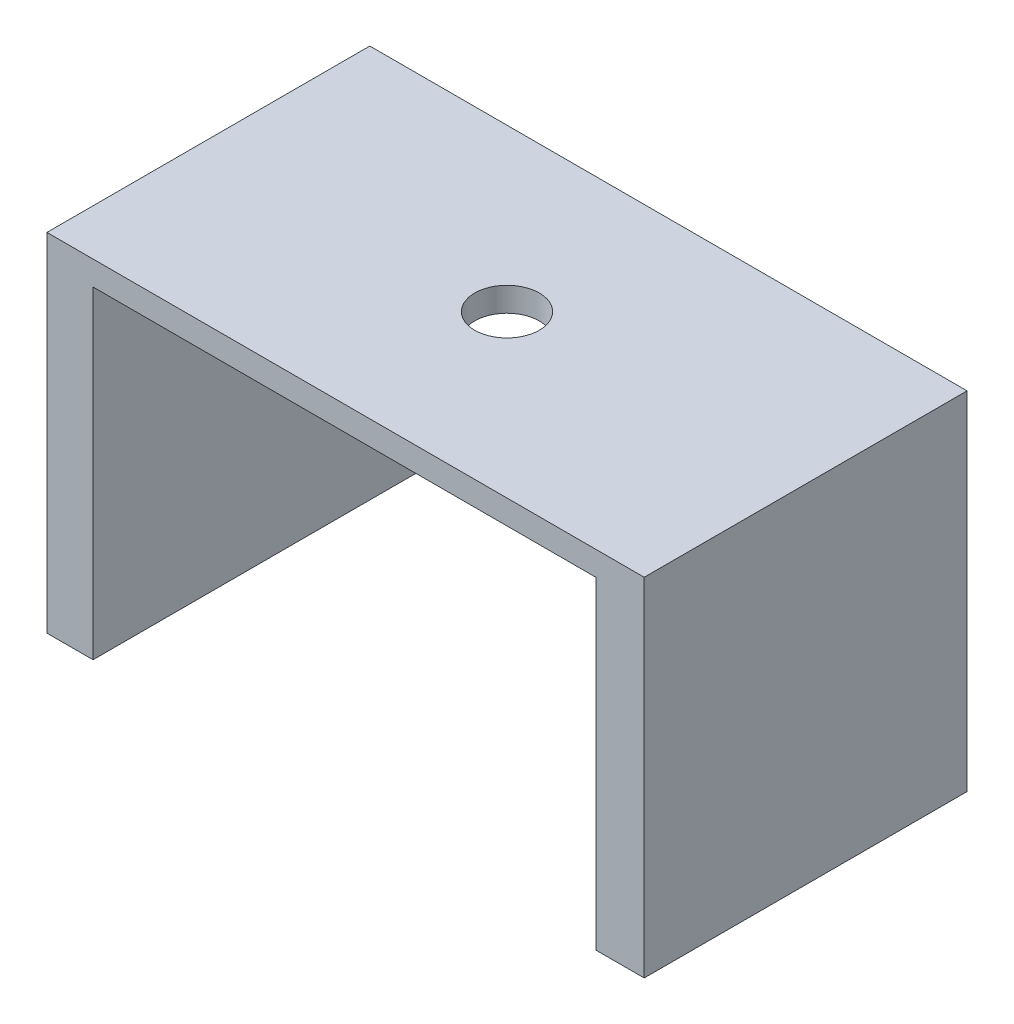
from build123d import *

# Parameters (mm, degrees)
SKETCH1_W           = 370
SKETCH1_H           = 200
BOSS_EXTRUDE1_DEPTH = 15
SKETCH2_W           = 28.561692334
SKETCH2_H           = 200
SKETCH2_W_2         = 30
BOSS_EXTRUDE2_DEPTH = 200
SKETCH3_R           = 20
CUT_EXTRUDE1_DEPTH  = 200


with BuildPart() as part:
    # Sketch1 → Boss-Extrude1 (new body)
    with BuildSketch(Plane(origin=(0, 0, 0), x_dir=(1, 0, 0), z_dir=(0, 1, 0))):
        Rectangle(SKETCH1_W, SKETCH1_H)
    extrude(amount=BOSS_EXTRUDE1_DEPTH)

    # Sketch2 → Boss-Extrude2 (add)
    with BuildSketch(Plane.XZ):
        with Locations((-170.719153833, 0)):
            Rectangle(SKETCH2_W, SKETCH2_H)
        with Locations((170, 0)):
            Rectangle(SKETCH2_W_2, SKETCH2_H)
    extrude(amount=BOSS_EXTRUDE2_DEPTH)

    # Sketch3 → Cut-Extrude1 (cut)
    with BuildSketch(Plane(origin=(0, 15, 0), x_dir=(1, 0, 0), z_dir=(0, 1, 0))):
        with Locations(Location((0, 0, 0), (0, 0, 270))):
            Circle(SKETCH3_R)
    extrude(amount=-CUT_EXTRUDE1_DEPTH, mode=Mode.SUBTRACT)


solid = part.part
